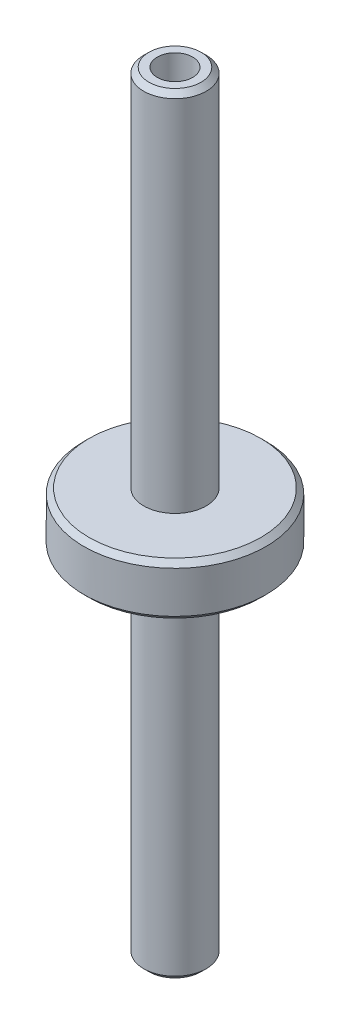
from build123d import *

# Parameters (mm, degrees)
CHAMFER1_SIZE         = 1
TROU_TARAUD_M81_D     = 6.8
TROU_TARAUD_M81_DEPTH = 22
TROU_TARAUD_M81_TIP   = 2.042926105


with BuildPart() as part:
    # Sketch1 → Revolve1 (revolve)
    with BuildSketch(Plane.XY):
        Polygon((0, 70), (0, -78), (-6, -78), (-6, -10), (-17.5, -10), (-17.5, 0), (-6, 0), (-6, 70), align=None)
    revolve(axis=Axis((0, 34.427667765, 0), (0, -1, 0)))

    # Chamfer1
    chamfer1_edges = [part.edges().sort_by_distance(p)[0] for p in [
        (6, 70, 0),
        (17.5, 0, 0),
        (17.5, -10, 0),
        (6, -78, 0),
    ]]
    chamfer(chamfer1_edges, length=CHAMFER1_SIZE)

    # Trou taraudé M81
    with Locations(Plane(origin=(0, 70, 0), x_dir=(1, 0, 0), z_dir=(0, 1, 0))):
        with Locations((0, 0)):
            Hole(TROU_TARAUD_M81_D / 2, depth=TROU_TARAUD_M81_DEPTH)
            with Locations((0, 0, -(TROU_TARAUD_M81_DEPTH + TROU_TARAUD_M81_TIP / 2))):  # 118° drill point
                Cone(0, TROU_TARAUD_M81_D / 2, TROU_TARAUD_M81_TIP, mode=Mode.SUBTRACT)


solid = part.part
